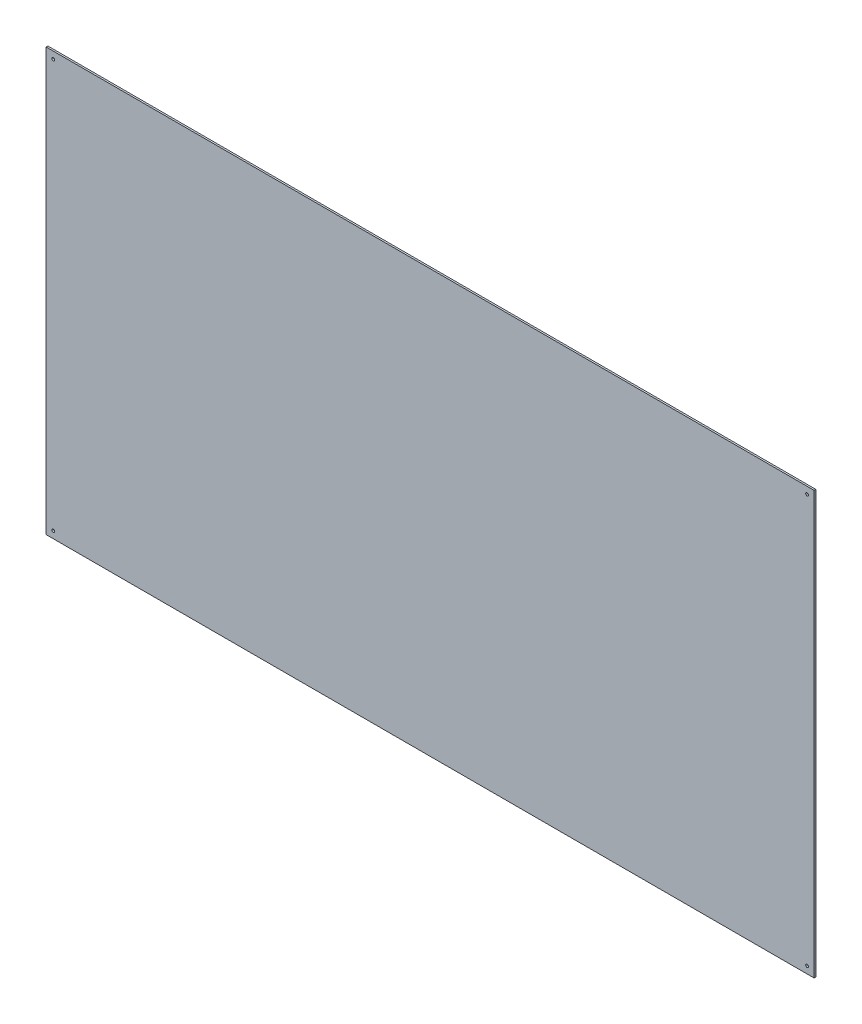
from build123d import *

# Parameters (mm, degrees)
SKETCH_1_W          = 2200
SKETCH_1_H          = 1210
EXTRUDE_1_DEPTH     = 5
SKETCH_3_R          = 4.05
CUT_EXTRUDE_1_DEPTH = 5


with BuildPart() as part:
    # 草图1 → 凸台-拉伸1 (new body)
    with BuildSketch(Plane.XY):
        Rectangle(SKETCH_1_W, SKETCH_1_H)
    extrude(amount=EXTRUDE_1_DEPTH)

    # 草图3 → 切除-拉伸1 (cut)
    with BuildSketch(Plane.XY.offset(5)):
        with Locations((-1080, 585)):
            Circle(SKETCH_3_R)
        with Locations(Location((-1080, -585, 0), (0, 0, 180))):
            Circle(SKETCH_3_R)
        with Locations((1080, -585)):
            Circle(SKETCH_3_R)
        with Locations(Location((1080, 585, 0), (0, 0, 180))):
            Circle(SKETCH_3_R)
    extrude(amount=-CUT_EXTRUDE_1_DEPTH, mode=Mode.SUBTRACT)


solid = part.part
